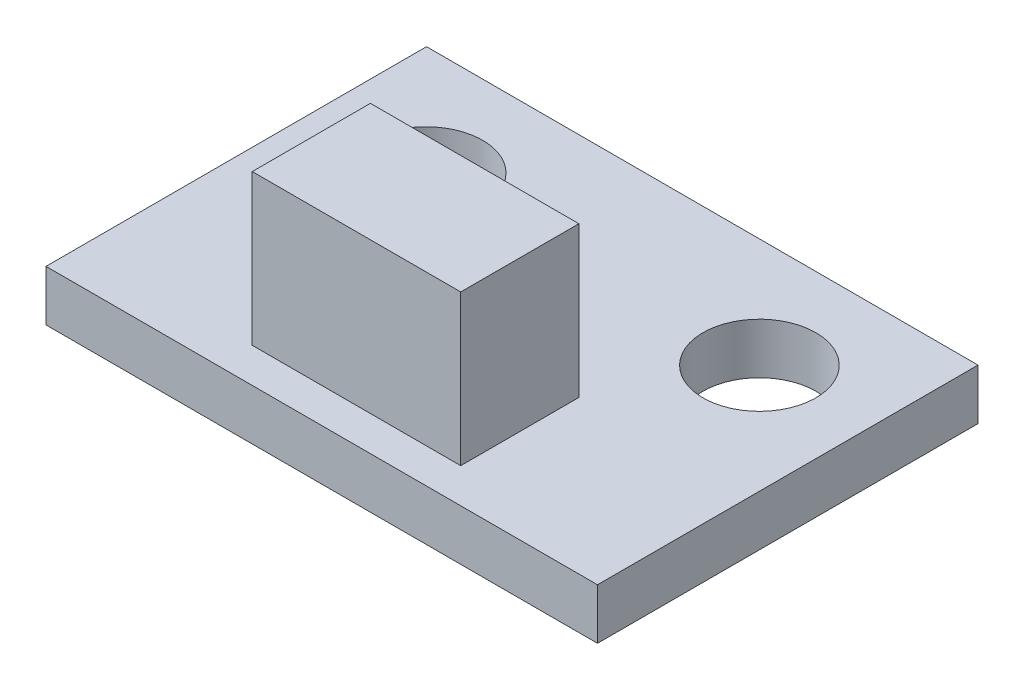
from build123d import *

# Parameters (mm, degrees)
SKETCH1_W           = 15.87
SKETCH1_H           = 10.95
SKETCH1_R           = 1.625
BOSS_EXTRUDE1_DEPTH = 1.46
SKETCH2_W           = 6
SKETCH2_H           = 3.4
BOSS_EXTRUDE2_DEPTH = 4.33


with BuildPart() as part:
    # Sketch1 → Boss-Extrude1 (new body)
    with BuildSketch(Plane(origin=(0, 0, 0), x_dir=(1, 0, 0), z_dir=(0, 1, 0))):
        Rectangle(SKETCH1_W, SKETCH1_H)
        with Locations(Location((-4.795, 2.325, 0), (0, 0, 270))):
            Circle(SKETCH1_R, mode=Mode.SUBTRACT)
        with Locations(Location((4.795, 2.325, 0), (0, 0, 90))):
            Circle(SKETCH1_R, mode=Mode.SUBTRACT)
    extrude(amount=BOSS_EXTRUDE1_DEPTH)

    # Sketch2 → Boss-Extrude2 (add)
    with BuildSketch(Plane(origin=(0, 1.46, 0), x_dir=(1, 0, 0), z_dir=(0, 1, 0))):
        with Locations((0, -2.775)):
            Rectangle(SKETCH2_W, SKETCH2_H)
    extrude(amount=BOSS_EXTRUDE2_DEPTH)


solid = part.part
